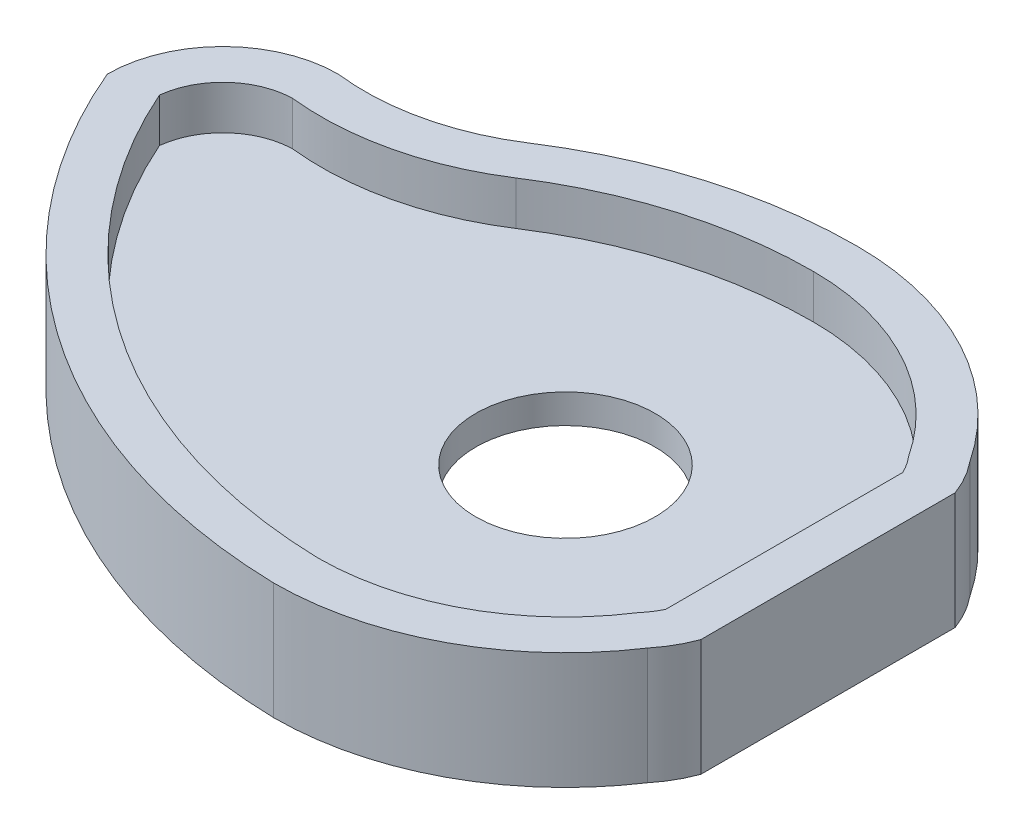
from build123d import *

# Parameters (mm, degrees)
BOSS_EXTRUDE1_DEPTH     = 6.35
BOSS_EXTRUDE3_DEPTH     = 25.4
CUT_EXTRUDE1_DEPTH      = 263.978228947
CUT_EXTRUDE1_DEPTH_BACK = 263.978228947
SKETCH2_R               = 39.05


with BuildPart() as part:
    # Sketch1 → Boss-Extrude1 (new, symmetric)
    with BuildSketch(Plane(origin=(0, 0, 0), x_dir=(1, 0, 0), z_dir=(0, 1, 0))):
        with BuildLine():
            Line((95.25, -51.587287188), (95.25, -42.12))
            Line((95.25, -42.12), (95.25, 42.12))
            Line((95.25, 42.12), (95.25, 51.587287188))
            ThreePointArc((95.25, 51.587287188), (93.136460997, 55.353844077), (90.531290228, 58.798707381))
            ThreePointArc((90.531290228, 58.798707381), (51.506708486, 94.86970792), (0, 107.95))
            ThreePointArc((0, 107.95), (-52.123153766, 100.419362872), (-99.983255054, 78.443367814))
            ThreePointArc((-99.983255054, 78.443367814), (-137.771381999, 62.338580791), (-178.772455636, 59.844855919))
            ThreePointArc((-178.772455636, 59.844855919), (-198.978805326, 51.581494612), (-208.83628251, 32.103048795))
            ThreePointArc((-208.83628251, 32.103048795), (-124.636067917, -68.271246819), (0.22501695, -107.949765481))
            ThreePointArc((0.22501695, -107.949765481), (51.605556398, -94.81597465), (90.531290228, -58.798707381))
            ThreePointArc((90.531290228, -58.798707381), (93.136460997, -55.353844077), (95.25, -51.587287188))
        make_face()
    extrude(amount=BOSS_EXTRUDE1_DEPTH, both=True)

    # Sketch1<4> → Boss-Extrude3 (add, symmetric)
    with BuildSketch(Plane(origin=(0, 0, 0), x_dir=(1, 0, 0), z_dir=(0, 1, 0))):
        with BuildLine():
            Line((114.3, -55.358016583), (114.3, 55.358016583))
            ThreePointArc((114.3, 55.358016583), (110.69531577, 63.1385236), (105.833333333, 70.201891396))
            ThreePointArc((105.833333333, 70.201891396), (60.055640005, 111.903172894), (0, 127))
            ThreePointArc((0, 127), (-57.515204156, 118.690331445), (-110.326350404, 94.440957588))
            ThreePointArc((-110.326350404, 94.440957588), (-142.699370878, 80.750483212), (-177.8, 78.91))
            ThreePointArc((-177.8, 78.91), (-213.353328958, 64.183328958), (-228.08, 28.63))
            ThreePointArc((-228.08, 28.63), (-137.03440171, -82.883921429), (0, -127))
            ThreePointArc((0, -127), (60.055640005, -111.903172894), (105.833333333, -70.201891396))
            ThreePointArc((105.833333333, -70.201891396), (110.69531577, -63.1385236), (114.3, -55.358016583))
        make_face()
        with BuildLine():
            Line((95.25, 42.12), (95.25, -42.12))
            Line((95.25, -42.12), (95.25, -51.587287188))
            ThreePointArc((95.25, -51.587287188), (93.136460997, -55.353844077), (90.531290228, -58.798707381))
            ThreePointArc((90.531290228, -58.798707381), (51.605556398, -94.81597465), (0.22501695, -107.949765481))
            ThreePointArc((0.22501695, -107.949765481), (-124.636067917, -68.271246819), (-208.83628251, 32.103048795))
            ThreePointArc((-208.83628251, 32.103048795), (-198.978805326, 51.581494612), (-178.772455636, 59.844855919))
            ThreePointArc((-178.772455636, 59.844855919), (-137.771381999, 62.338580791), (-99.983255054, 78.443367814))
            ThreePointArc((-99.983255054, 78.443367814), (-52.123153766, 100.419362872), (0, 107.95))
            ThreePointArc((0, 107.95), (51.506708486, 94.86970792), (90.531290228, 58.798707381))
            ThreePointArc((90.531290228, 58.798707381), (93.136460997, 55.353844077), (95.25, 51.587287188))
            Line((95.25, 51.587287188), (95.25, 42.12))
        make_face(mode=Mode.SUBTRACT)
    extrude(amount=BOSS_EXTRUDE3_DEPTH, both=True)

    # Sketch2 → Cut-Extrude1 (cut, two sides: drawn at the far end of the back side and taken through both)
    with BuildSketch(Plane(origin=(0, 6.35, 0), x_dir=(1, 0, 0), z_dir=(0, 1, 0)).offset(-CUT_EXTRUDE1_DEPTH_BACK)):
        Circle(SKETCH2_R)
    extrude(amount=CUT_EXTRUDE1_DEPTH + CUT_EXTRUDE1_DEPTH_BACK, mode=Mode.SUBTRACT)


solid = part.part
